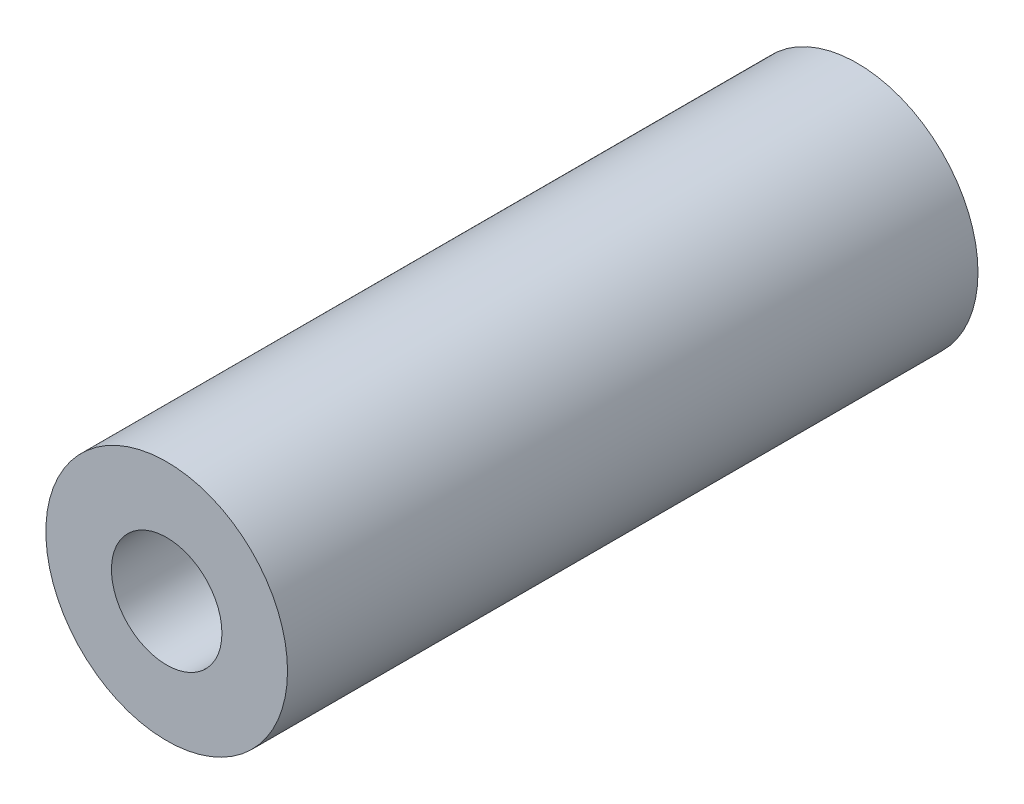
from build123d import *

# Parameters (mm, degrees)
SKETCH1_R           = 3.5
SKETCH1_R_2         = 1.6
BOSS_EXTRUDE1_DEPTH = 20


with BuildPart() as part:
    # Sketch1 → Boss-Extrude1 (new body)
    with BuildSketch(Plane.XY):
        Circle(SKETCH1_R)
        Circle(SKETCH1_R_2, mode=Mode.SUBTRACT)
    extrude(amount=BOSS_EXTRUDE1_DEPTH)


solid = part.part
